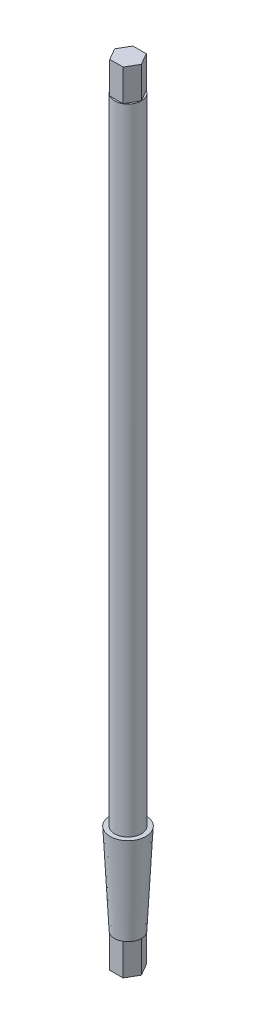
from build123d import *

# Parameters (mm, degrees)
BOSS_EXTRUDE1_DEPTH = 7
SKETCH2_R           = 2.95
BOSS_EXTRUDE2_DEPTH = 160
SKETCH5_R           = 2.95
SKETCH4_R           = 3.95
BOSS_EXTRUDE3_DEPTH = 7


with BuildPart() as part:
    # Sketch1 → Boss-Extrude1 (new body)
    with BuildSketch(Plane(origin=(0, 0, 0), x_dir=(1, 0, 0), z_dir=(0, 1, 0))):
        Polygon((1.475, -2.554774941), (2.95, 0), (1.475, 2.554774941), (-1.475, 2.554774941), (-2.95, 0), (-1.475, -2.554774941), align=None)
    extrude(amount=BOSS_EXTRUDE1_DEPTH)

    # Sketch2 → Boss-Extrude2 (add)
    with BuildSketch(Plane(origin=(0, 7, 0), x_dir=(1, 0, 0), z_dir=(0, 1, 0))):
        with Locations(Location((0, 0, 0), (0, 0, 60))):
            Circle(SKETCH2_R)
    extrude(amount=BOSS_EXTRUDE2_DEPTH)

    # Sketch5 → Loft1 section 0
    with BuildSketch(Plane.XZ.offset(-7)):
        Circle(SKETCH5_R)
    # Sketch4 → Loft1 section 1
    with BuildSketch(Plane(origin=(0, 27, 0), x_dir=(-1, 0, 0), z_dir=(0, -1, 0))):
        Circle(SKETCH4_R)
    loft()

    # Sketch6 → Boss-Extrude3 (add)
    with BuildSketch(Plane(origin=(0, 167, 0), x_dir=(1, 0, 0), z_dir=(0, 1, 0))):
        Polygon((1.475, -2.554774941), (2.95, 0), (1.475, 2.554774941), (-1.475, 2.554774941), (-2.95, 0), (-1.475, -2.554774941), align=None)
    extrude(amount=BOSS_EXTRUDE3_DEPTH)


solid = part.part
